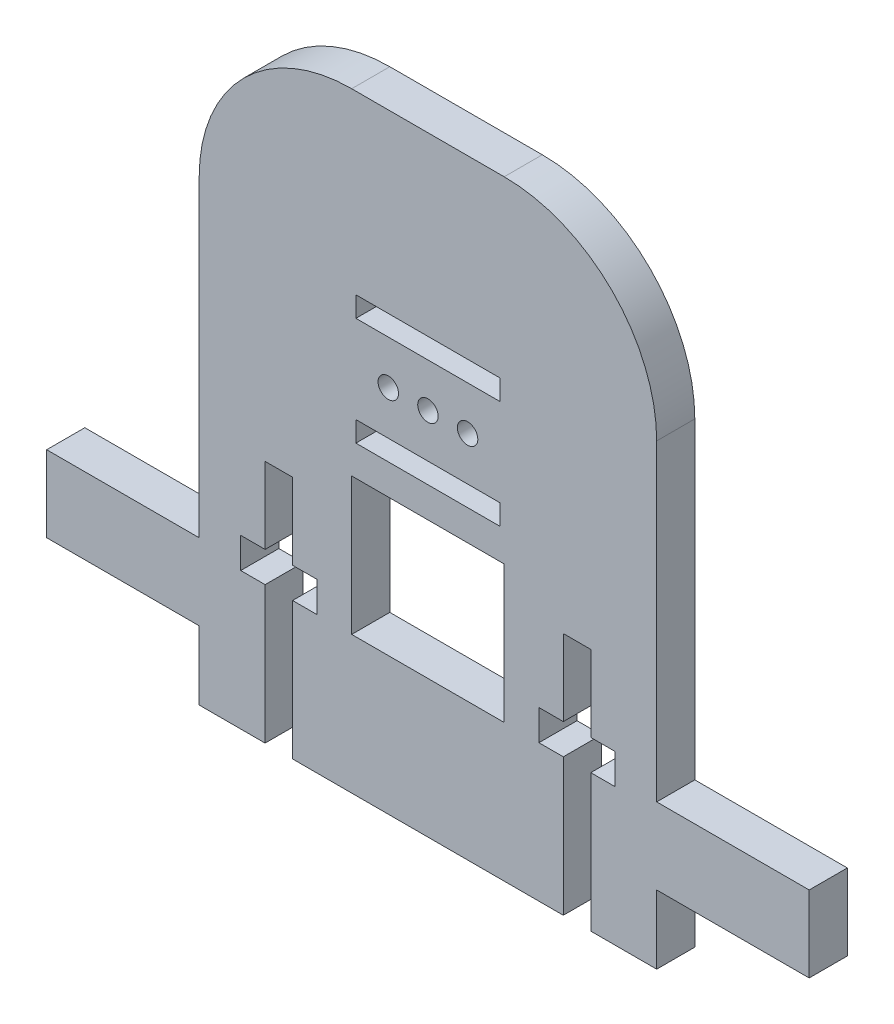
from build123d import *

# Parameters (mm, degrees)
BOSS_EXTRUDE1_DEPTH = 3.175
FILLET1_R           = 12.7
SKETCH2_R           = 0.85
SKETCH2_W           = 12
SKETCH2_H           = 1.7
CUT_EXTRUDE1_DEPTH  = 41.783613437
SKETCH3_W           = 2.286
SKETCH3_H           = 20.32
SKETCH3_W_2         = 12.7
SKETCH3_H_2         = 11.43
SKETCH3_W_3         = 6.35
SKETCH3_H_3         = 2.54
CUT_EXTRUDE2_DEPTH  = 41.783613437


with BuildPart() as part:
    # Sketch1 → Boss-Extrude1 (new body)
    with BuildSketch(Plane.XY):
        Polygon((19.05, -25.4), (-19.05, -25.4), (-19.05, -19.685), (-31.75, -19.685), (-31.75, -13.335), (-19.05, -13.335), (-19.05, 25.4), (19.05, 25.4), (19.05, -13.335), (31.75, -13.335), (31.75, -19.685), (19.05, -19.685), align=None)
    extrude(amount=BOSS_EXTRUDE1_DEPTH)

    # Fillet1
    fillet1_edges = [part.edges().sort_by_distance(p)[0] for p in [
        (-19.05, 25.4, 1.5875),
        (19.05, 25.4, 1.5875),
    ]]
    fillet(fillet1_edges, radius=FILLET1_R)

    # Sketch2 → Cut-Extrude1 (cut, through all)
    with BuildSketch(Plane.XY):
        with Locations((0, 5.364988)):
            Circle(SKETCH2_R)
        with Locations((-3.302, 5.364988)):
            Circle(SKETCH2_R)
        with Locations(Location((3.302, 5.364988, 0), (0, 0, 180))):
            Circle(SKETCH2_R)
        with Locations((0, 0.864988)):
            Rectangle(SKETCH2_W, SKETCH2_H)
        with Locations((0, 9.864988)):
            Rectangle(SKETCH2_W, SKETCH2_H)
    extrude(amount=CUT_EXTRUDE1_DEPTH, mode=Mode.SUBTRACT)

    # Sketch3 → Cut-Extrude2 (cut, through all)
    with BuildSketch(Plane.XY):
        with Locations((-12.4167697, -15.24)):
            Rectangle(SKETCH3_W, SKETCH3_H)
        with Locations((0, -8.240012)):
            Rectangle(SKETCH3_W_2, SKETCH3_H_2)
        with Locations((-12.4167697, -12.7)):
            Rectangle(SKETCH3_W_3, SKETCH3_H_3)
        with Locations((12.4167697, -12.7)):
            Rectangle(SKETCH3_W_3, SKETCH3_H_3)
        with Locations((12.4167697, -15.24)):
            Rectangle(SKETCH3_W, SKETCH3_H)
    extrude(amount=CUT_EXTRUDE2_DEPTH, mode=Mode.SUBTRACT)


solid = part.part
